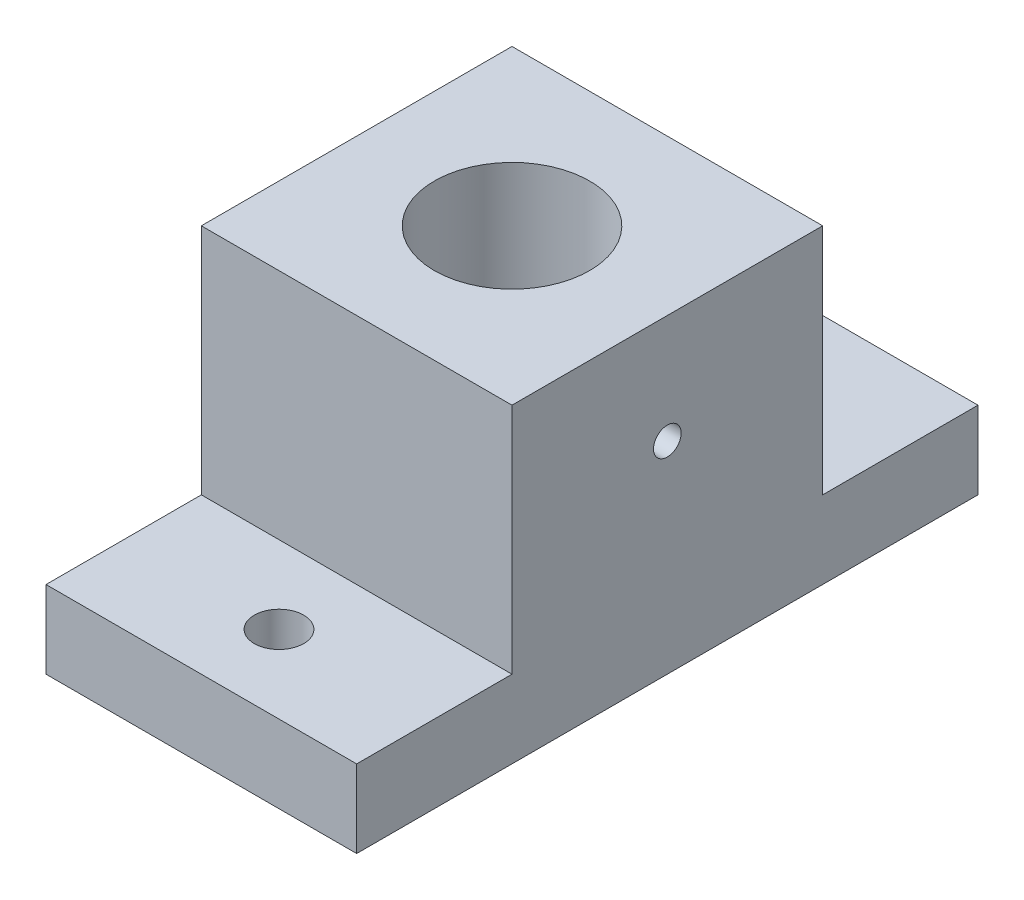
from build123d import *

# Parameters (mm, degrees)
SKETCH1_W                  = 25.4
SKETCH1_H                  = 50.8
BOSS_EXTRUDE1_DEPTH        = 6.35
SKETCH2_W                  = 25.4
SKETCH2_H                  = 25.4
BOSS_EXTRUDE2_DEPTH        = 19.05
SKETCH3_R                  = 6.35
CUT_EXTRUDE1_DEPTH         = 39.1
F_10_32_TAPPED_HOLE1_D     = 4.0386
F_4_40_TAPPED_HOLE1_REACH  = 45.994
F_4_40_TAPPED_HOLE1_BORE_R = 1.1303


with BuildPart() as part:
    # Sketch1 → Boss-Extrude1 (new body)
    with BuildSketch(Plane(origin=(0, 0, 0), x_dir=(1, 0, 0), z_dir=(0, 1, 0))):
        Rectangle(SKETCH1_W, SKETCH1_H)
    extrude(amount=BOSS_EXTRUDE1_DEPTH)

    # Sketch2 → Boss-Extrude2 (add)
    with BuildSketch(Plane(origin=(0, 6.35, 0), x_dir=(1, 0, 0), z_dir=(0, 1, 0))):
        Rectangle(SKETCH2_W, SKETCH2_H)
    extrude(amount=BOSS_EXTRUDE2_DEPTH)

    # Sketch3 → Cut-Extrude1 (cut, through all)
    with BuildSketch(Plane(origin=(0, 25.4, 0), x_dir=(1, 0, 0), z_dir=(0, 1, 0))):
        with Locations(Location((0, 0, 0), (0, 0, 270))):
            Circle(SKETCH3_R)
    extrude(amount=-CUT_EXTRUDE1_DEPTH, mode=Mode.SUBTRACT)

    # #10-32 Tapped Hole1 (through all)
    with Locations(Plane(origin=(0, 6.35, 0), x_dir=(1, 0, 0), z_dir=(0, 1, 0))):
        with Locations((0, 19.05), (0, -19.05)):
            Hole(F_10_32_TAPPED_HOLE1_D / 2)

    # #4-40 Tapped Hole1 bore → #4-40 Tapped Hole1 (cut, up to next)
    with BuildSketch(Plane(origin=(12.7, 0, 0), x_dir=(0, 0, -1), z_dir=(1, 0, 0)), mode=Mode.PRIVATE) as f_4_40_tapped_hole1_sk1:
        with Locations((0, 16.51)):
            Circle(F_4_40_TAPPED_HOLE1_BORE_R)
    f_4_40_tapped_hole1_tool1 = extrude(f_4_40_tapped_hole1_sk1.sketch, amount=-F_4_40_TAPPED_HOLE1_REACH, mode=Mode.PRIVATE) & part.part
    add(f_4_40_tapped_hole1_tool1.solids().sort_by_distance((12.7, 16.51, 0))[0], mode=Mode.SUBTRACT)


solid = part.part
